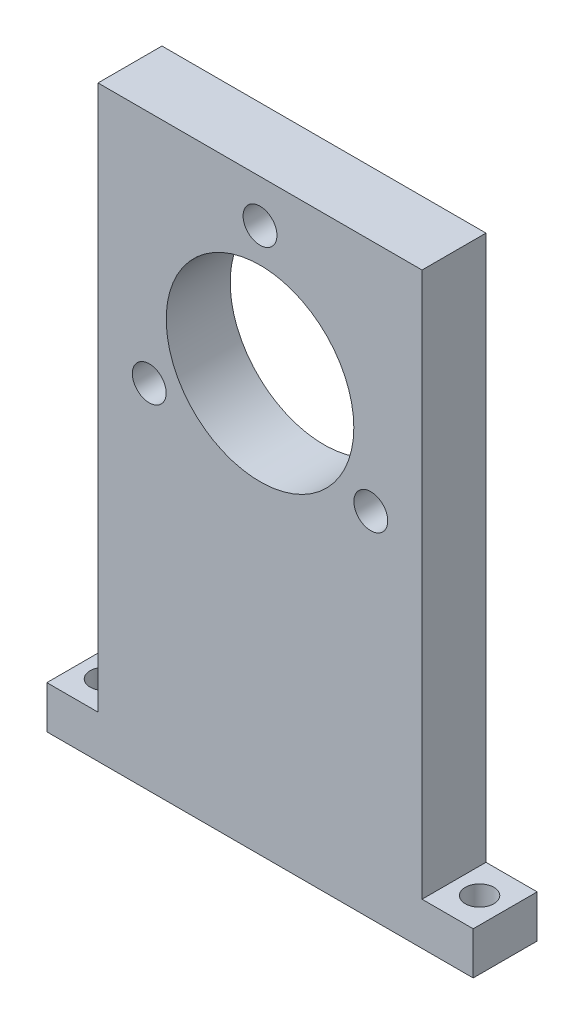
from build123d import *

# Parameters (mm, degrees)
SKETCH2_R           = 11
BOSS_EXTRUDE1_DEPTH = 7.5
SKETCH5_R           = 1.984375
CUT_EXTRUDE3_DEPTH  = 74.683320442
CIRPATTERN1_COUNT   = 3
SKETCH6_R           = 1.675
CUT_EXTRUDE4_DEPTH  = 70.030252146


with BuildPart() as part:
    # Sketch2 → Boss-Extrude1 (new body)
    with BuildSketch(Plane.XY):
        Polygon((-25, 0), (25, 0), (25, 5), (19, 5), (19, 68.9056), (-19, 68.9056), (-19, 5), (-25, 5), align=None)
        with Locations((0, 48.9056)):
            Circle(SKETCH2_R, mode=Mode.SUBTRACT)
    extrude(amount=-BOSS_EXTRUDE1_DEPTH)

    # Sketch5 → Cut-Extrude3 (cut, through all)
    with BuildSketch(Plane.XY):
        with Locations((0, 63.9056)):
            Circle(SKETCH5_R)
    cut_extrude3 = extrude(amount=-CUT_EXTRUDE3_DEPTH, mode=Mode.SUBTRACT)

    # CirPattern1: Cut-Extrude3 ×3 about axis
    cirpattern1_axis = Axis((0, 48.9056, 0), (0, 0, 1))
    for i in range(1, CIRPATTERN1_COUNT):
        add(cut_extrude3.rotate(cirpattern1_axis, i * 360 / CIRPATTERN1_COUNT), mode=Mode.SUBTRACT)

    # Sketch6 → Cut-Extrude4 (cut, through all)
    with BuildSketch(Plane(origin=(0, 5, 0), x_dir=(1, 0, 0), z_dir=(0, 1, 0))):
        with Locations(Location((22, 3.75, 0), (0, 0, 270))):
            Circle(SKETCH6_R)
        with Locations(Location((-22, 3.75, 0), (0, 0, 270))):
            Circle(SKETCH6_R)
    extrude(amount=-CUT_EXTRUDE4_DEPTH, mode=Mode.SUBTRACT)


solid = part.part
